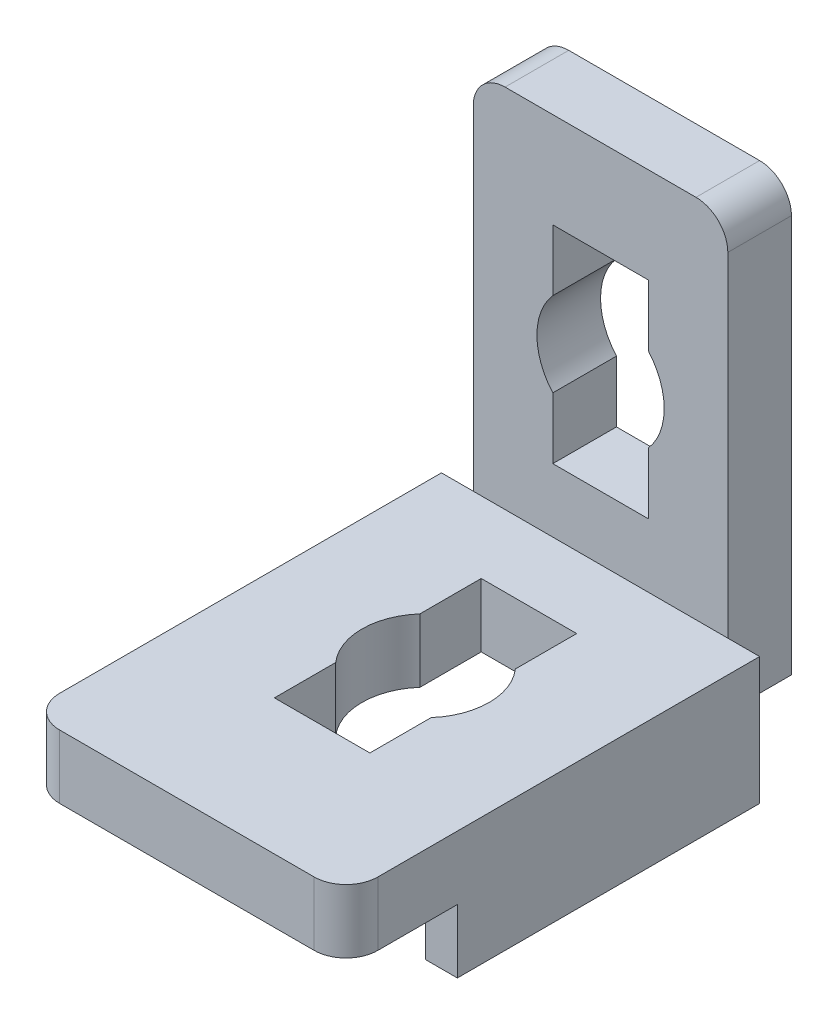
from build123d import *

# Parameters (mm, degrees)
SKETCH_1_W          = 8
SKETCH_1_H          = 13.5
EXTRUDE_1_DEPTH     = 2
EXTRUDE_2_DEPTH     = 2
SKETCH_3_W          = 1
SKETCH_3_H          = 9.5
EXTRUDE_3_DEPTH     = 2
CUT_EXTRUDE_1_REACH = 22.791
CUT_EXTRUDE_2_REACH = 21.397
FILLET_1_R          = 1


with BuildPart() as part:
    # 草图1 → 凸台-拉伸1 (new body)
    with BuildSketch(Plane.XY):
        with Locations((0, 6.75)):
            Rectangle(SKETCH_1_W, SKETCH_1_H)
    extrude(amount=EXTRUDE_1_DEPTH)

    # 草图2 → 凸台-拉伸2 (add)
    with BuildSketch(Plane(origin=(0, 0, 0), x_dir=(-1, 0, 0), z_dir=(0, -1, 0))):
        Polygon((-4, -2), (-5, -2), (-5, -15), (5, -15), (5, -2), (4, -2), (4, 0), (-4, 0), align=None)
    extrude(amount=-EXTRUDE_2_DEPTH)

    # 草图3 → 凸台-拉伸3 (add)
    with BuildSketch(Plane(origin=(0, 0, 0), x_dir=(-1, 0, 0), z_dir=(0, -1, 0))):
        with Locations((4.5, -6.75)):
            Rectangle(SKETCH_3_W, SKETCH_3_H)
        with Locations((-4.5, -6.75)):
            Rectangle(SKETCH_3_W, SKETCH_3_H)
    extrude(amount=EXTRUDE_3_DEPTH)

    # 草图4 → 切除-拉伸1 (cut, up to next)
    with BuildSketch(Plane(origin=(0, 0, 0), x_dir=(-1, 0, 0), z_dir=(0, -1, 0)), mode=Mode.PRIVATE) as cut_extrude_1_sk1:
        with BuildLine():
            Line((1.5, -8.822875656), (1.5, -10.75))
            Line((1.5, -10.75), (-1.5, -10.75))
            Line((-1.5, -10.75), (-1.5, -8.822875656))
            ThreePointArc((-1.5, -8.822875656), (-2, -7.5), (-1.5, -6.177124344))
            Line((-1.5, -6.177124344), (-1.5, -4.25))
            Line((-1.5, -4.25), (1.5, -4.25))
            Line((1.5, -4.25), (1.5, -6.177124344))
            ThreePointArc((1.5, -6.177124344), (2, -7.5), (1.5, -8.822875656))
        make_face()
    cut_extrude_1_tool1 = extrude(cut_extrude_1_sk1.sketch, amount=-CUT_EXTRUDE_1_REACH, mode=Mode.PRIVATE) & part.part
    add(cut_extrude_1_tool1.solids().sort_by_distance((0, 0, 7.5))[0], mode=Mode.SUBTRACT)

    # 草图5 → 切除-拉伸2 (cut, up to next)
    with BuildSketch(Plane.XY.offset(2), mode=Mode.PRIVATE) as cut_extrude_2_sk1:
        with BuildLine():
            Line((-1.5, 8.572875656), (-1.5, 10.5))
            Line((-1.5, 10.5), (1.5, 10.5))
            Line((1.5, 10.5), (1.5, 8.572875656))
            ThreePointArc((1.5, 8.572875656), (2, 7.25), (1.5, 5.927124344))
            Line((1.5, 5.927124344), (1.5, 4))
            Line((1.5, 4), (-1.5, 4))
            Line((-1.5, 4), (-1.5, 5.927124344))
            ThreePointArc((-1.5, 5.927124344), (-2, 7.25), (-1.5, 8.572875656))
        make_face()
    cut_extrude_2_tool1 = extrude(cut_extrude_2_sk1.sketch, amount=-CUT_EXTRUDE_2_REACH, mode=Mode.PRIVATE) & part.part
    add(cut_extrude_2_tool1.solids().sort_by_distance((0, 7.25, 2))[0], mode=Mode.SUBTRACT)

    # 圆角1
    fillet_1_edges = [part.edges().sort_by_distance(p)[0] for p in [
        (-5, 1, 15),
        (5, 1, 15),
        (-4, 13.5, 1),
        (4, 13.5, 1),
    ]]
    fillet(fillet_1_edges, radius=FILLET_1_R)


solid = part.part
